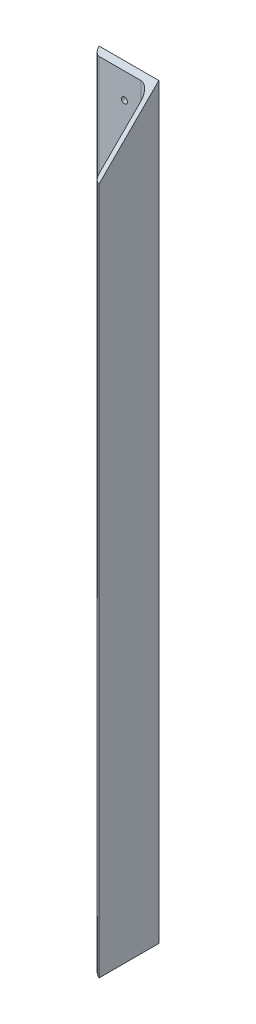
from build123d import *

# Parameters (mm, degrees)
L_ANGLE_EQUAL_40X40X3_1_DEPTH = 500
CUT_EXTRUDE1_DEPTH            = 504.189825016
CUT_EXTRUDE2_DEPTH            = 504.189825016
SKETCH16_R                    = 2
CUT_EXTRUDE3_DEPTH            = 10


with BuildPart() as part:
    # Sketch11 → L angle (equal) 40X40X3(1) (new body)
    with BuildSketch(Plane(origin=(0, 0, 0), x_dir=(-1, 0, 0), z_dir=(0, 1, 0))):
        with BuildLine():
            Line((0, 40), (0, 0))
            Line((0, 0), (40, 0))
            ThreePointArc((40, 0), (39.121320344, 2.121320344), (37, 3))
            Line((37, 3), (9, 3))
            ThreePointArc((9, 3), (4.757359313, 4.757359313), (3, 9))
            Line((3, 9), (3, 37))
            ThreePointArc((3, 37), (2.121320344, 39.121320344), (0, 40))
        make_face()
    extrude(amount=L_ANGLE_EQUAL_40X40X3_1_DEPTH)

    # Sketch12 → Cut-Extrude1 (cut, through all)
    with BuildSketch(Plane(origin=(0, 0, 0), x_dir=(0, 0, -1), z_dir=(1, 0, 0))):
        Polygon((0, 500), (-40, 500), (-40, 460), align=None)
    extrude(amount=-CUT_EXTRUDE1_DEPTH, mode=Mode.SUBTRACT)

    # Sketch14 → Cut-Extrude2 (cut, through all)
    with BuildSketch(Plane(origin=(0, 0, 0), x_dir=(-1, 0, 0), z_dir=(0, 0, -1))):
        Polygon((40, 40), (0, 0), (40, 0), align=None)
    extrude(amount=-CUT_EXTRUDE2_DEPTH, mode=Mode.SUBTRACT)

    # Sketch16 → Cut-Extrude3 (cut)
    with BuildSketch(Plane(origin=(0, 0, 0), x_dir=(-1, 0, 0), z_dir=(0, 0, -1))):
        with Locations((20, 480)):
            Circle(SKETCH16_R)
        with Locations((20, 20)):
            Circle(SKETCH16_R)
    extrude(amount=-CUT_EXTRUDE3_DEPTH, mode=Mode.SUBTRACT)


solid = part.part
